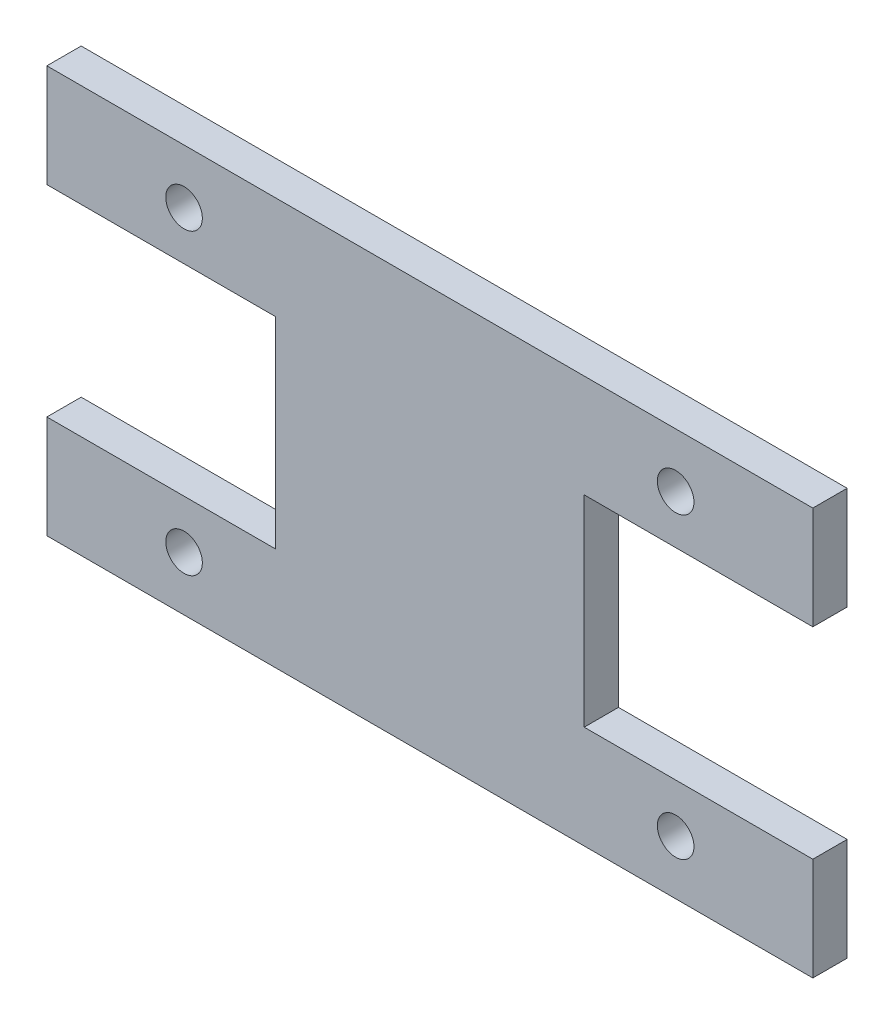
from build123d import *

# Parameters (mm, degrees)
SKETCH_1_R      = 1.6
EXTRUDE_1_DEPTH = 3


with BuildPart() as part:
    # 草图1 → 凸台-拉伸1 (new body)
    with BuildSketch(Plane.XY):
        Polygon((-45, 0), (-45, 9), (-65, 9), (-65, 26.6), (-45, 26.6), (-45, 35.6), (-112, 35.6), (-112, 26.6), (-92, 26.6), (-92, 9), (-112, 9), (-112, 0), align=None)
        with Locations((-57, 4.75)):
            Circle(SKETCH_1_R, mode=Mode.SUBTRACT)
        with Locations((-57, 30.85)):
            Circle(SKETCH_1_R, mode=Mode.SUBTRACT)
        with Locations((-100, 4.75)):
            Circle(SKETCH_1_R, mode=Mode.SUBTRACT)
        with Locations((-100, 30.85)):
            Circle(SKETCH_1_R, mode=Mode.SUBTRACT)
    extrude(amount=EXTRUDE_1_DEPTH)


solid = part.part
